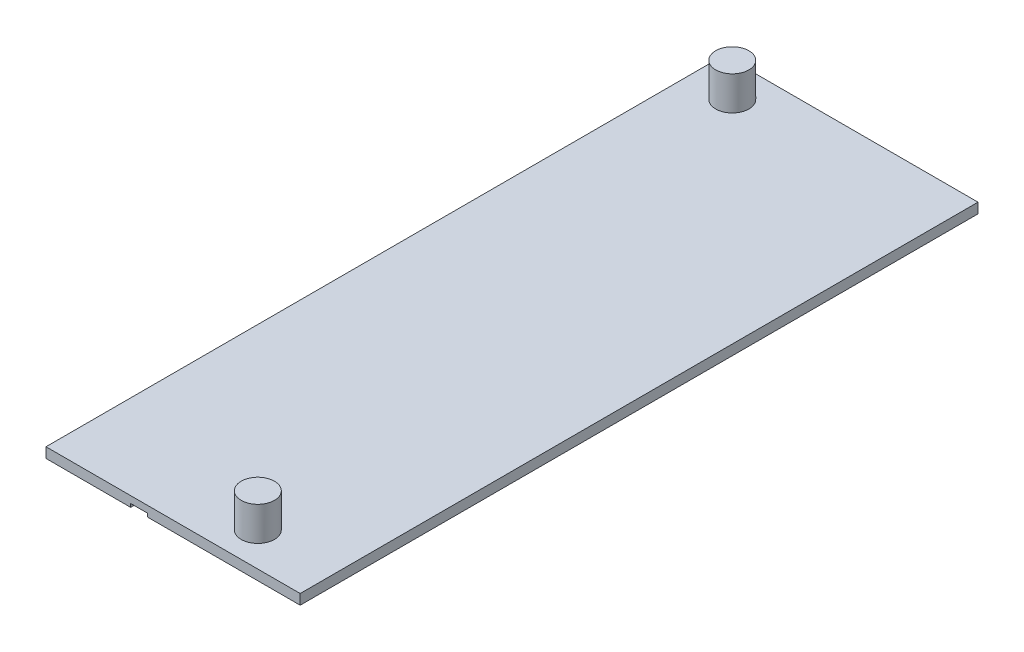
from build123d import *

# Parameters (mm, degrees)
SKETCH1_W           = 75
SKETCH1_H           = 3
BOSS_EXTRUDE1_DEPTH = 200
SKETCH2_R           = 4.9
BOSS_EXTRUDE2_DEPTH = 10
SKETCH3_W           = 7
SKETCH3_H           = 33
SKETCH3_W_2         = 5
SKETCH3_H_2         = 30
CUT_EXTRUDE1_DEPTH  = 1


with BuildPart() as part:
    # Sketch1 → Boss-Extrude1 (new body)
    with BuildSketch(Plane.XY):
        with Locations((37.5, 1.5)):
            Rectangle(SKETCH1_W, SKETCH1_H)
    extrude(amount=BOSS_EXTRUDE1_DEPTH)

    # Sketch2 → Boss-Extrude2 (add)
    with BuildSketch(Plane(origin=(0, 3, 0), x_dir=(1, 0, 0), z_dir=(0, 1, 0))):
        with Locations(Location((12.5, -10, 0), (0, 0, 90))):
            Circle(SKETCH2_R)
        with Locations(Location((52.5, -190, 0), (0, 0, 90))):
            Circle(SKETCH2_R)
    extrude(amount=BOSS_EXTRUDE2_DEPTH)

    # Sketch3 → Cut-Extrude1 (cut)
    with BuildSketch(Plane.XZ):
        with Locations((7.5, 26.5)):
            Rectangle(SKETCH3_W, SKETCH3_H)
        with Locations((7.5, 63.5)):
            Rectangle(SKETCH3_W, SKETCH3_H)
        with Locations((27.5, 135)):
            Rectangle(SKETCH3_W_2, SKETCH3_H_2)
        with Locations((22.5, 26.5)):
            Rectangle(SKETCH3_W, SKETCH3_H)
        with Locations((22.5, 63.5)):
            Rectangle(SKETCH3_W, SKETCH3_H)
        with Locations((37.5, 26.5)):
            Rectangle(SKETCH3_W, SKETCH3_H)
        with Locations((37.5, 63.5)):
            Rectangle(SKETCH3_W, SKETCH3_H)
        with Locations((52.5, 26.5)):
            Rectangle(SKETCH3_W, SKETCH3_H)
        with Locations((52.5, 63.5)):
            Rectangle(SKETCH3_W, SKETCH3_H)
        with Locations((67.5, 26.5)):
            Rectangle(SKETCH3_W, SKETCH3_H)
        with Locations((67.5, 63.5)):
            Rectangle(SKETCH3_W, SKETCH3_H)
        with Locations((27.5, 185)):
            Rectangle(SKETCH3_W_2, SKETCH3_H_2)
    extrude(amount=-CUT_EXTRUDE1_DEPTH, mode=Mode.SUBTRACT)


solid = part.part
